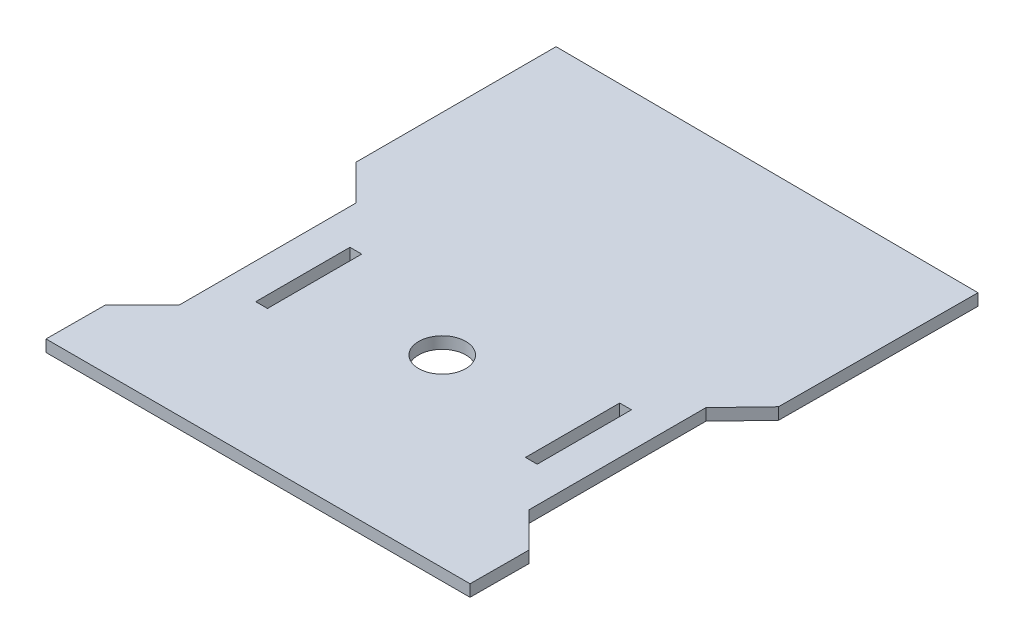
from build123d import *

# Parameters (mm, degrees)
BOSS_EXTRUDE1_DEPTH = 5
CUT_EXTRUDE2_DEPTH  = 5
SKETCH5_W           = 5
SKETCH5_H           = 40
CUT_EXTRUDE3_DEPTH  = 10
SKETCH6_R           = 10
CUT_EXTRUDE4_DEPTH  = 10


with BuildPart() as part:
    # Sketch2 → Boss-Extrude1 (new body)
    with BuildSketch(Plane(origin=(0, 0, 0), x_dir=(1, 0, 0), z_dir=(0, 1, 0))):
        Polygon((-124.760229314, 128.809560066), (55.239770686, 127.913370731), (54.741887722, 27.913370731), (39.741887722, 27.913370731), (39.741887722, -47.086629269), (54.542734536, -61.887476084), (54.418263795, -86.887476084), (-125.581736205, -86.887476084), (-125.457265464, -61.887476084), (-109.760229314, -46.190439934), (-109.760229314, 28.809560066), (-124.760229314, 28.809560066), align=None)
    extrude(amount=BOSS_EXTRUDE1_DEPTH)

    # Sketch4 → Cut-Extrude2 (cut)
    with BuildSketch(Plane(origin=(0, 5, 0), x_dir=(1, 0, 0), z_dir=(0, 1, 0))):
        Polygon((-109.760229314, 28.809560066), (-124.760229314, 43.809560066), (-124.760229314, 28.809560066), align=None)
        Polygon((39.741887722, 27.913370731), (54.820327412, 43.668014969), (54.741887722, 27.913370731), align=None)
    extrude(amount=-CUT_EXTRUDE2_DEPTH, mode=Mode.SUBTRACT)

    # Sketch5 → Cut-Extrude3 (cut)
    with BuildSketch(Plane(origin=(0, 5, 0), x_dir=(1, 0, 0), z_dir=(0, 1, 0))):
        with Locations((-92.260229314, -8.690439934)):
            Rectangle(SKETCH5_W, SKETCH5_H)
        with Locations((22.241887722, -8.690439934)):
            Rectangle(SKETCH5_W, SKETCH5_H)
    extrude(amount=-CUT_EXTRUDE3_DEPTH, mode=Mode.SUBTRACT)

    # Sketch6 → Cut-Extrude4 (cut)
    with BuildSketch(Plane(origin=(0, 5, 0), x_dir=(1, 0, 0), z_dir=(0, 1, 0))):
        with Locations(Location((-35.581736205, -8.690439934, 0), (0, 0, 270))):
            Circle(SKETCH6_R)
    extrude(amount=-CUT_EXTRUDE4_DEPTH, mode=Mode.SUBTRACT)


solid = part.part
